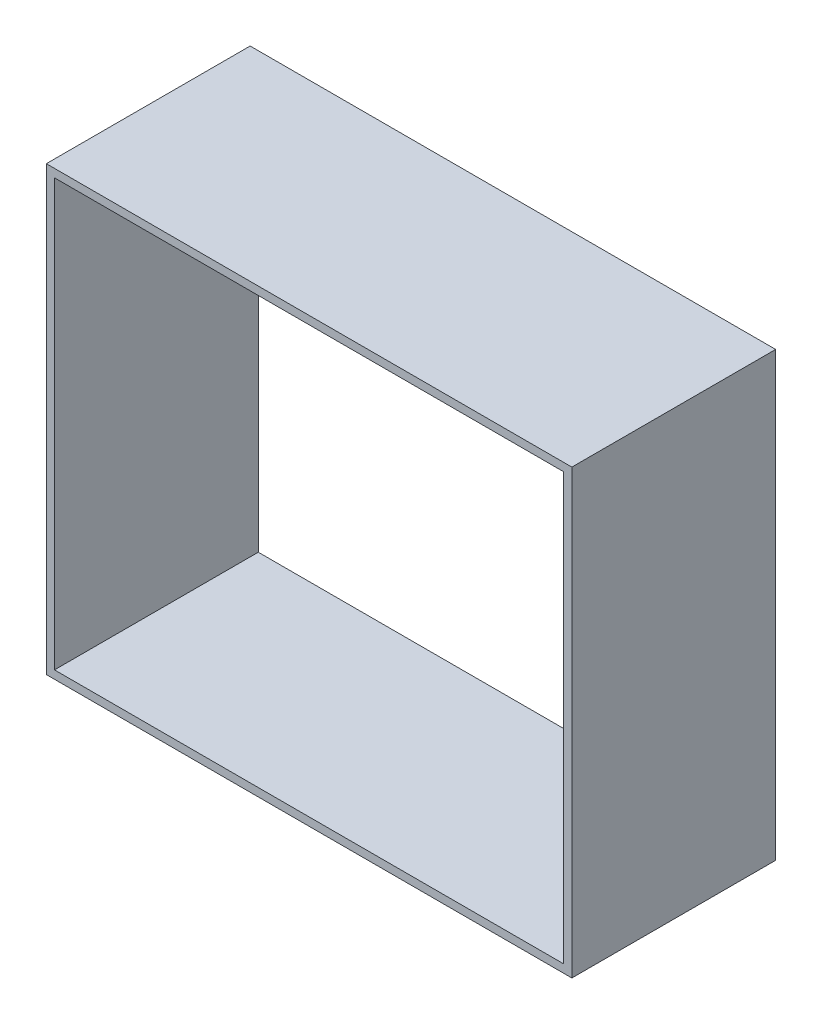
from build123d import *

# Parameters (mm, degrees)
SKETCH1_W             = 128.922622712
SKETCH1_H             = 108.547542538
SKETCH1_W_2           = 124.922622712
SKETCH1_H_2           = 104.547542538
BOSS_EXTRUDE1_DEPTH   = 50
SKETCH2_R             = 48.496570744
BOSS_EXTRUDE2_DEPTH   = 50
SKETCH3_R             = 6.994110628
BOSS_EXTRUDE3_DEPTH   = 20
SKETCH3_R_2           = 6.120691225
BOSS_EXTRUDE3_2_DEPTH = 20


with BuildPart() as part:
    # Sketch1 → Boss-Extrude1 (new body)
    with BuildSketch(Plane.XY):
        Rectangle(SKETCH1_W, SKETCH1_H)
        Rectangle(SKETCH1_W_2, SKETCH1_H_2, mode=Mode.SUBTRACT)
    extrude(amount=BOSS_EXTRUDE1_DEPTH)


with BuildPart() as body_2:
    # Sketch2 → Boss-Extrude2 (new body)
    with BuildSketch(Plane.XY):
        with Locations(Location((0, 0, 0), (0, 0, 180))):
            Circle(SKETCH2_R)
    extrude(amount=BOSS_EXTRUDE2_DEPTH)


with BuildPart() as body_3:
    # Sketch3 → Boss-Extrude3 (new body)
    with BuildSketch(Plane.XY):
        with Locations((-51.126362865, 41.516845757)):
            Circle(SKETCH3_R)
    extrude(amount=BOSS_EXTRUDE3_DEPTH)


with BuildPart() as body_4:
    # Sketch3 → Boss-Extrude3 2 (new body)
    with BuildSketch(Plane.XY):
        with Locations((46.461548735, 43.755956539)):
            Circle(SKETCH3_R_2)
    extrude(amount=BOSS_EXTRUDE3_2_DEPTH)


solid = part.part
